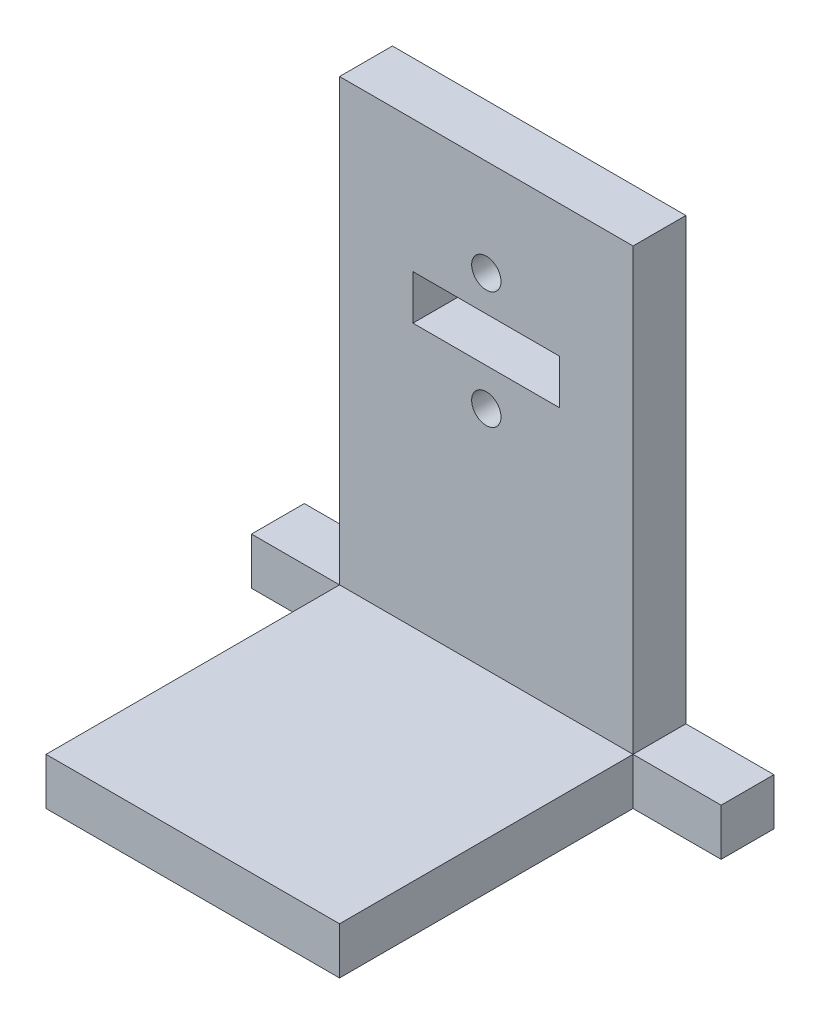
from build123d import *

# Parameters (mm, degrees)
ESQUISSE1_R        = 2.5
ESQUISSE1_W        = 25
ESQUISSE1_H        = 7.609144865
BOSS_EXTRU_1_DEPTH = 9
ESQUISSE2_W        = 49.997440748
ESQUISSE2_H        = 8
BOSS_EXTRU_2_DEPTH = 50


with BuildPart() as part:
    # Esquisse1 → Boss.-Extru.1 (new body)
    with BuildSketch(Plane.XY):
        Polygon((1.553236782, 0), (81.553236782, 0), (81.553236782, 8), (66.553236782, 8), (66.553236782, 83), (16.553236782, 83), (16.553236782, 8), (1.553236782, 8), align=None)
        with Locations((41.553236782, 46.5)):
            Circle(ESQUISSE1_R, mode=Mode.SUBTRACT)
        with Locations((41.553236782, 66.5)):
            Circle(ESQUISSE1_R, mode=Mode.SUBTRACT)
        with Locations((41.553236782, 56.667811129)):
            Rectangle(ESQUISSE1_W, ESQUISSE1_H, mode=Mode.SUBTRACT)
    extrude(amount=-BOSS_EXTRU_1_DEPTH)

    # Esquisse2 → Boss.-Extru.2 (add)
    with BuildSketch(Plane.XY):
        with Locations((41.551957156, 4)):
            Rectangle(ESQUISSE2_W, ESQUISSE2_H)
    extrude(amount=BOSS_EXTRU_2_DEPTH)


solid = part.part
